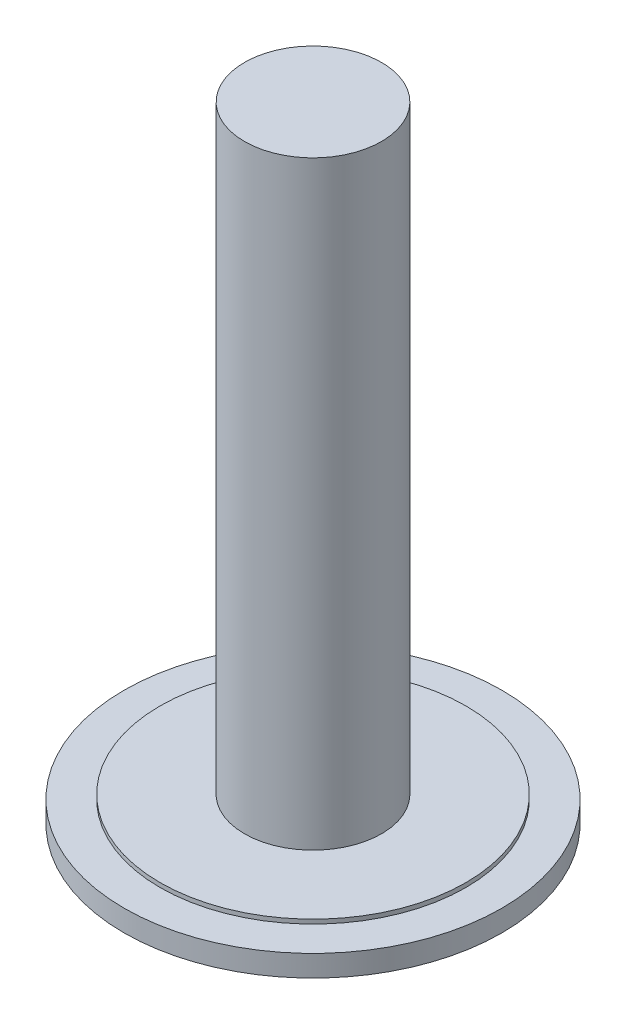
from build123d import *

# Parameters (mm, degrees)
SKETCH1_R           = 11.025
BOSS_EXTRUDE1_DEPTH = 1.5
CUT_EXTRUDE1_START  = -0.25
SKETCH2_R           = 11.025
SKETCH2_R_2         = 8.930457304
CUT_EXTRUDE1_DEPTH  = 0.25
SKETCH3_R           = 4
BOSS_EXTRUDE2_DEPTH = 35


with BuildPart() as part:
    # Sketch1 → Boss-Extrude1 (new body)
    with BuildSketch(Plane(origin=(0, 0, 0), x_dir=(1, 0, 0), z_dir=(0, 1, 0))):
        with Locations(Location((0, 0, 0), (0, 0, 270))):
            Circle(SKETCH1_R)
    extrude(amount=BOSS_EXTRUDE1_DEPTH)

    # Sketch2 → Cut-Extrude1 (cut)
    with BuildSketch(Plane(origin=(0, 1.5, 0), x_dir=(1, 0, 0), z_dir=(0, 1, 0)).offset(CUT_EXTRUDE1_START)):
        with Locations(Location((0, 0, 0), (0, 0, 270))):
            Circle(SKETCH2_R)
        with Locations(Location((0, 0, 0), (0, 0, 270))):
            Circle(SKETCH2_R_2, mode=Mode.SUBTRACT)
    extrude(amount=CUT_EXTRUDE1_DEPTH, mode=Mode.SUBTRACT)

    # Sketch3 → Boss-Extrude2 (add)
    with BuildSketch(Plane(origin=(0, 1.5, 0), x_dir=(1, 0, 0), z_dir=(0, 1, 0))):
        with Locations(Location((0, 0, 0), (0, 0, 270))):
            Circle(SKETCH3_R)
    extrude(amount=BOSS_EXTRUDE2_DEPTH)


solid = part.part
